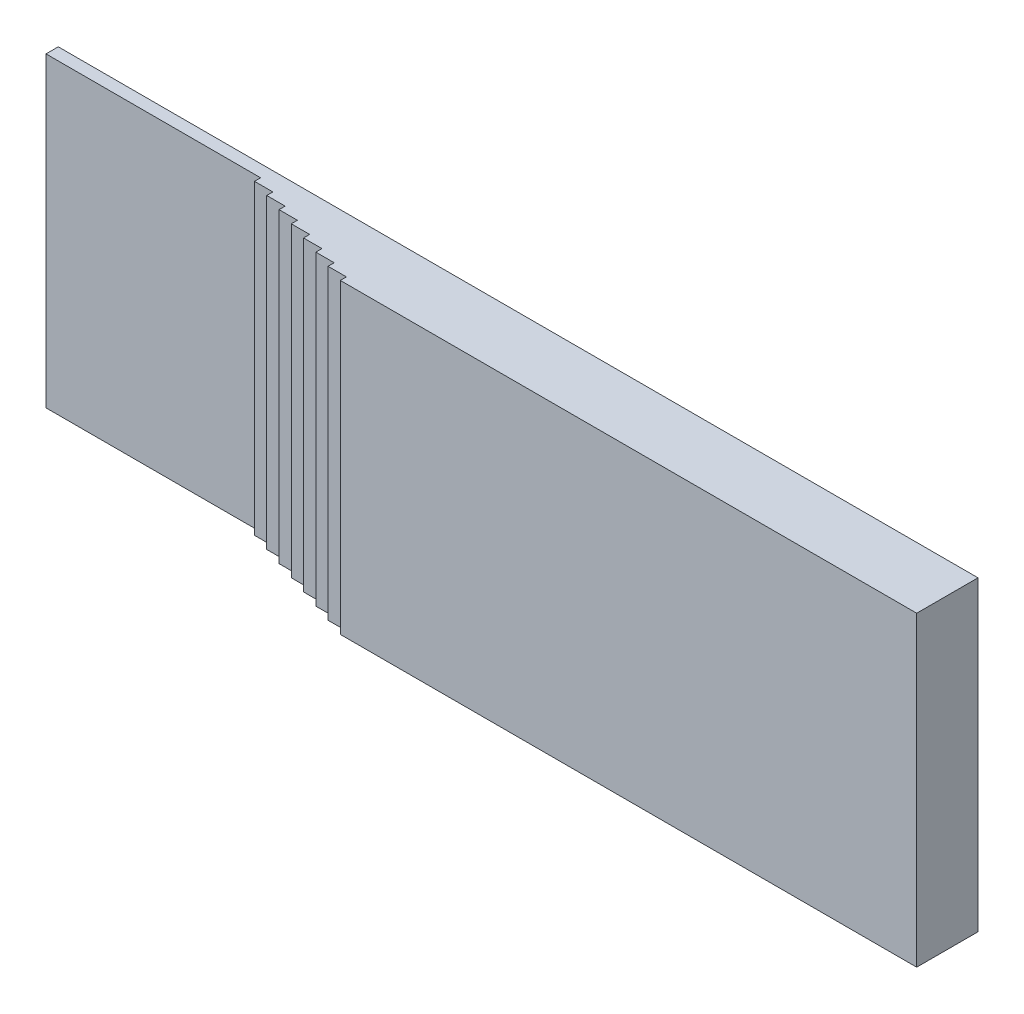
from build123d import *

# Parameters (mm, degrees)
SKETCH3_W           = 15000
SKETCH3_H           = 5000
BOSS_EXTRUDE1_DEPTH = 200
SKETCH4_W           = 300
SKETCH4_H           = 5000
STEP1_DEPTH         = 100
SKETCH4_4_W         = 300
SKETCH4_4_H         = 5000
STEP2_DEPTH         = 200
SKETCH4_5_W         = 300
SKETCH4_5_H         = 5000
STEP3_DEPTH         = 300
SKETCH4_6_W         = 300
SKETCH4_6_H         = 5000
STEP4_DEPTH         = 400
SKETCH4_7_W         = 300
SKETCH4_7_H         = 5000
STEP5_DEPTH         = 500
SKETCH4_8_W         = 300
SKETCH4_8_H         = 5000
STEP6_DEPTH         = 600
SKETCH4_9_W         = 300
SKETCH4_9_H         = 5000
STEP7_DEPTH         = 700
SKETCH4_10_W        = 300
SKETCH4_10_H        = 5000
STEP8_DEPTH         = 800
SKETCH8_W           = 9100
SKETCH8_H           = 5000
STEP9_DEPTH         = 800


with BuildPart() as part:
    # Sketch3 → Boss-Extrude1 (new body)
    with BuildSketch(Plane.XY):
        with Locations((5000, 0)):
            Rectangle(SKETCH3_W, SKETCH3_H)
    extrude(amount=BOSS_EXTRUDE1_DEPTH)

    # Sketch4 → Step1 (add)
    with BuildSketch(Plane.XY.offset(200)):
        with Locations((1150, 0)):
            Rectangle(SKETCH4_W, SKETCH4_H)
    extrude(amount=STEP1_DEPTH)

    # Sketch4<4> → Step2 (add)
    with BuildSketch(Plane.XY.offset(200)):
        with Locations((1450, 0)):
            Rectangle(SKETCH4_4_W, SKETCH4_4_H)
    extrude(amount=STEP2_DEPTH)

    # Sketch4<5> → Step3 (add)
    with BuildSketch(Plane.XY.offset(200)):
        with Locations((1750, 0)):
            Rectangle(SKETCH4_5_W, SKETCH4_5_H)
    extrude(amount=STEP3_DEPTH)

    # Sketch4<6> → Step4 (add)
    with BuildSketch(Plane.XY.offset(200)):
        with Locations((2050, 0)):
            Rectangle(SKETCH4_6_W, SKETCH4_6_H)
    extrude(amount=STEP4_DEPTH)

    # Sketch4<7> → Step5 (add)
    with BuildSketch(Plane.XY.offset(200)):
        with Locations((2350, 0)):
            Rectangle(SKETCH4_7_W, SKETCH4_7_H)
    extrude(amount=STEP5_DEPTH)

    # Sketch4<8> → Step6 (add)
    with BuildSketch(Plane.XY.offset(200)):
        with Locations((2650, 0)):
            Rectangle(SKETCH4_8_W, SKETCH4_8_H)
    extrude(amount=STEP6_DEPTH)

    # Sketch4<9> → Step7 (add)
    with BuildSketch(Plane.XY.offset(200)):
        with Locations((2950, 0)):
            Rectangle(SKETCH4_9_W, SKETCH4_9_H)
    extrude(amount=STEP7_DEPTH)

    # Sketch4<10> → Step8 (add)
    with BuildSketch(Plane.XY.offset(200)):
        with Locations((3250, 0)):
            Rectangle(SKETCH4_10_W, SKETCH4_10_H)
    extrude(amount=STEP8_DEPTH)

    # Sketch8 → Step9 (add)
    with BuildSketch(Plane.XY.offset(200)):
        with Locations((7950, 0)):
            Rectangle(SKETCH8_W, SKETCH8_H)
    extrude(amount=STEP9_DEPTH)


solid = part.part
